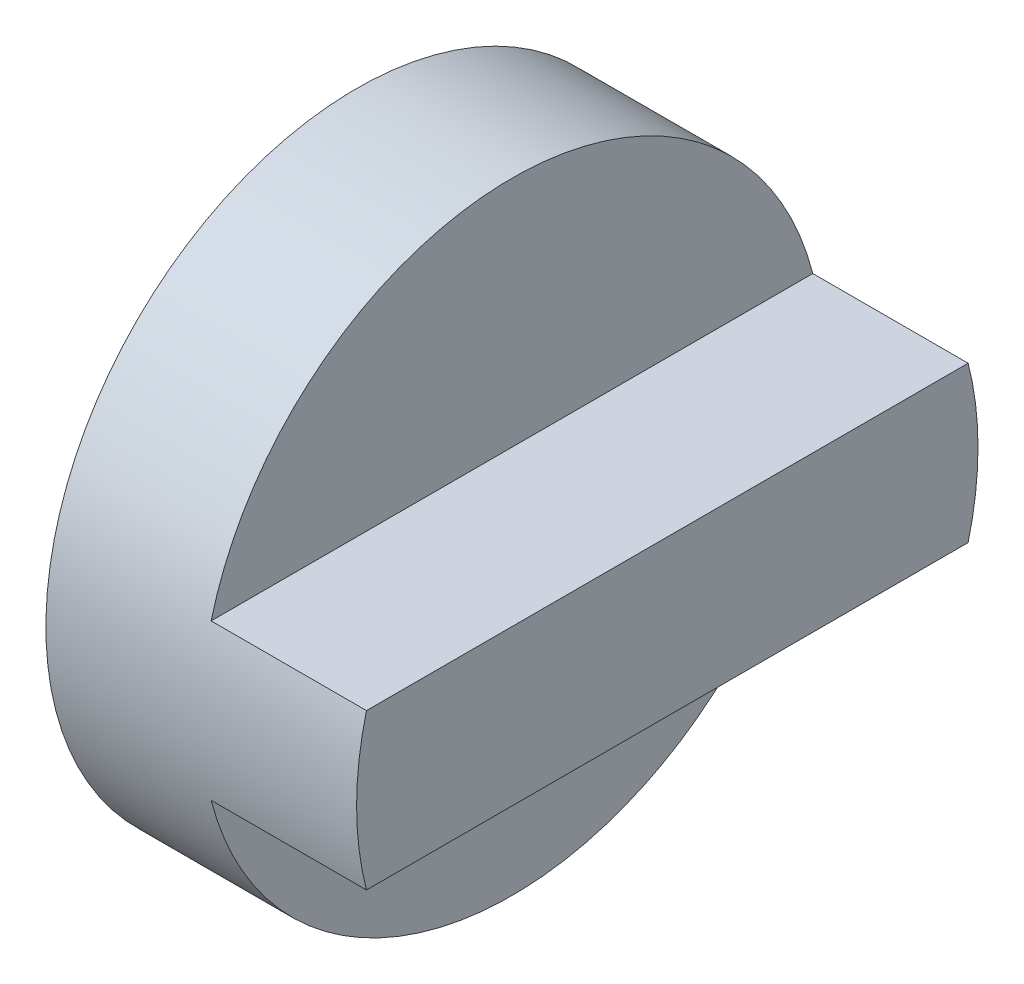
from build123d import *

# Parameters (mm, degrees)
SKETCH2_R           = 20
BOSS_EXTRUDE1_DEPTH = 10
BOSS_EXTRUDE2_DEPTH = 10


with BuildPart() as part:
    # Sketch2 → Boss-Extrude1 (new body)
    with BuildSketch(Plane(origin=(0, 0, 0), x_dir=(0, 0, -1), z_dir=(1, 0, 0))):
        Circle(SKETCH2_R)
    extrude(amount=BOSS_EXTRUDE1_DEPTH)

    # Sketch3 → Boss-Extrude2 (add)
    with BuildSketch(Plane(origin=(10, 0, 0), x_dir=(0, 0, -1), z_dir=(1, 0, 0))):
        with BuildLine():
            Line((19.364916731, 5), (-19.364916731, 5))
            ThreePointArc((-19.364916731, 5), (-20, 0), (-19.364916731, -5))
            Line((-19.364916731, -5), (19.364916731, -5))
            ThreePointArc((19.364916731, -5), (20, 0), (19.364916731, 5))
        make_face()
    extrude(amount=BOSS_EXTRUDE2_DEPTH)


solid = part.part
